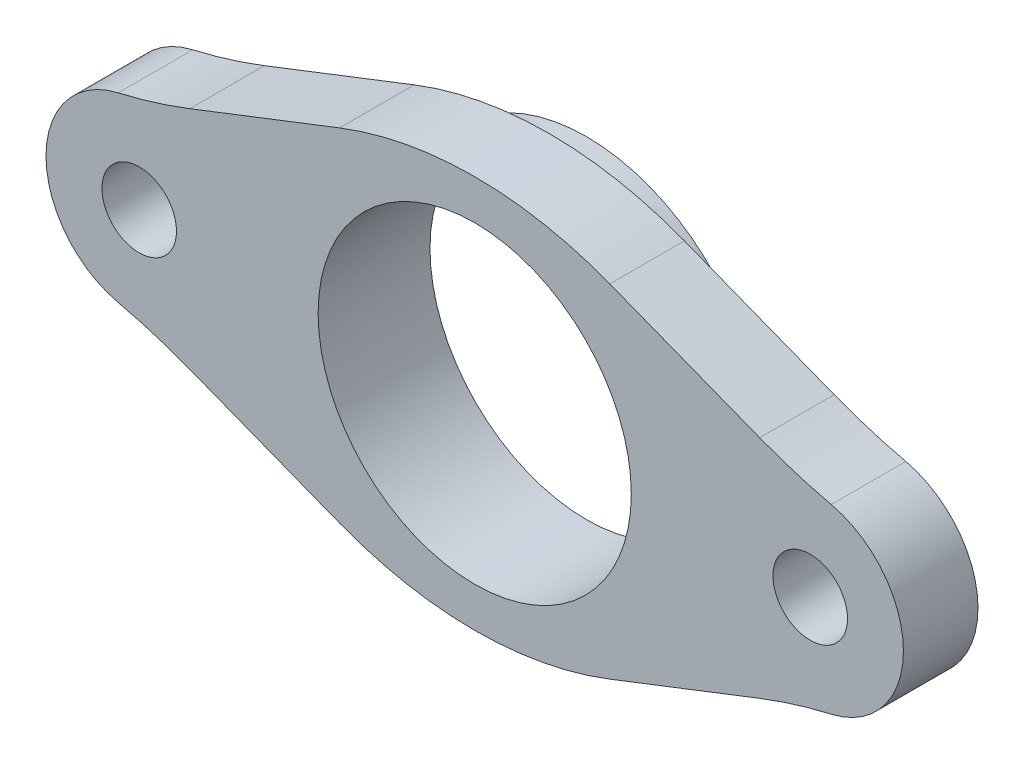
from build123d import *

# Parameters (mm, degrees)
SKETCH1_R           = 21
SKETCH1_R_2         = 5
BOSS_EXTRUDE1_DEPTH = 10
FILLET1_R           = 50
FILLET2_R           = 70
BOSS_EXTRUDE2_START = -15
SKETCH2_R           = 23.5
SKETCH2_R_2         = 21
BOSS_EXTRUDE2_DEPTH = 15


with BuildPart() as part:
    # Sketch1 → Boss-Extrude1 (new body)
    with BuildSketch(Plane.XY):
        with BuildLine():
            Line((-54.365348895, 227.889389357), (-99.36593713, 245.389389357))
            Line((-99.36593713, 245.389389357), (-144.365348895, 227.889389357))
            ThreePointArc((-144.365348895, 227.889389357), (-156.865348895, 215.389389357), (-144.365348895, 202.889389357))
            Line((-144.365348895, 202.889389357), (-99.36593713, 185.389389357))
            Line((-99.36593713, 185.389389357), (-54.365348895, 202.889389357))
            ThreePointArc((-54.365348895, 202.889389357), (-41.865348895, 215.389389357), (-54.365348895, 227.889389357))
        make_face()
        with Locations((-99.36593713, 215.389389357)):
            Circle(SKETCH1_R, mode=Mode.SUBTRACT)
        with Locations((-54.365348895, 215.389389357)):
            Circle(SKETCH1_R_2, mode=Mode.SUBTRACT)
        with Locations((-144.365348895, 215.389389357)):
            Circle(SKETCH1_R_2, mode=Mode.SUBTRACT)
    extrude(amount=BOSS_EXTRUDE1_DEPTH)

    # Fillet1
    fillet1_edges = [part.edges().sort_by_distance(p)[0] for p in [
        (-99.36593713, 185.389389357, 5),
        (-99.36593713, 245.389389357, 5),
    ]]
    fillet(fillet1_edges, radius=FILLET1_R)

    # Fillet2
    fillet2_edges = [part.edges().sort_by_distance(p)[0] for p in [
        (-54.365348895, 202.889389357, 5),
        (-144.365348895, 202.889389357, 5),
        (-144.365348895, 227.889389357, 5),
        (-54.365348895, 227.889389357, 5),
    ]]
    fillet(fillet2_edges, radius=FILLET2_R)

    # Sketch2 → Boss-Extrude2 (add)
    with BuildSketch(Plane.XY.offset(10).offset(BOSS_EXTRUDE2_START)):
        with Locations((-99.36593713, 215.389389357)):
            Circle(SKETCH2_R)
        with Locations((-99.36593713, 215.389389357)):
            Circle(SKETCH2_R_2, mode=Mode.SUBTRACT)
    extrude(amount=BOSS_EXTRUDE2_DEPTH)


solid = part.part
